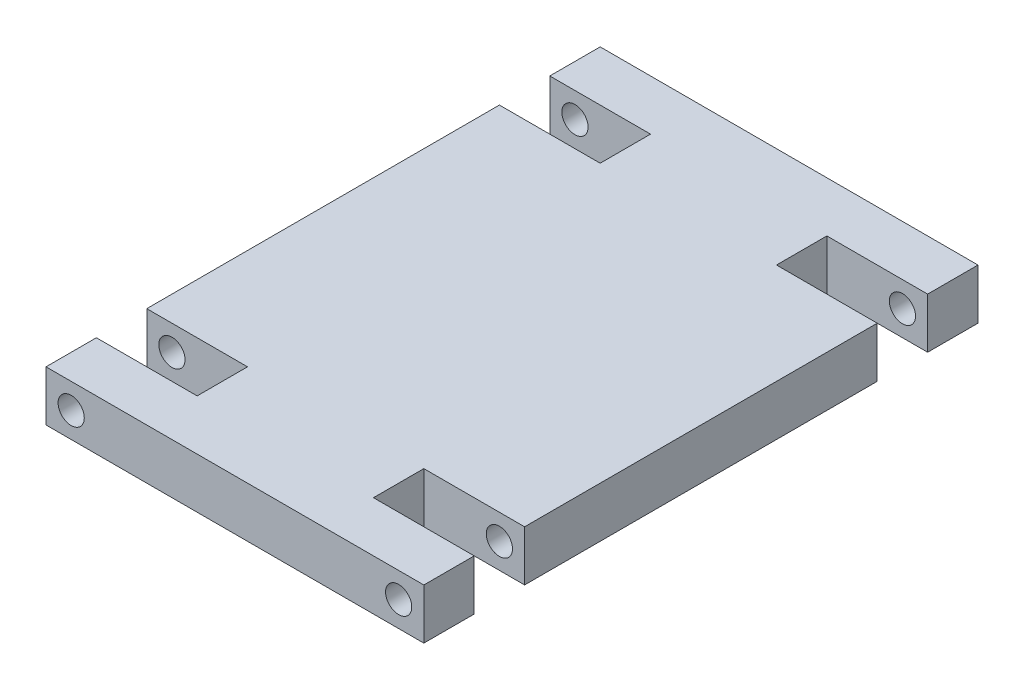
from build123d import *

# Parameters (mm, degrees)
SALIENTE_EXTRUIR1_DEPTH    = 5
CORTAR_EXTRUIR1_DEPTH      = 67.755149614
CORTAR_EXTRUIR1_DEPTH_BACK = 67.755149614
CROQUIS2_R                 = 2.6


with BuildPart() as part:
    # Croquis1 → Saliente-Extruir1 (new, symmetric)
    with BuildSketch(Plane(origin=(0, 0, 0), x_dir=(1, 0, 0), z_dir=(0, 1, 0))):
        Polygon((37.5, 45), (17.5, 45), (17.5, 35), (37.5, 35), (37.5, -35), (17.5, -35), (17.5, -45), (37.5, -45), (37.5, -55), (-37.5, -55), (-37.5, -45), (-17.5, -45), (-17.5, -35), (-37.5, -35), (-37.5, 35), (-17.5, 35), (-17.5, 45), (-37.5, 45), (-37.5, 55), (37.5, 55), align=None)
    extrude(amount=SALIENTE_EXTRUIR1_DEPTH, both=True)

    # Croquis2 → Cortar-Extruir1 (cut, two sides: drawn at the far end of the back side and taken through both)
    with BuildSketch(Plane.XY.offset(-CORTAR_EXTRUIR1_DEPTH_BACK)):
        with Locations((32.5, 0)):
            Circle(CROQUIS2_R)
        with Locations(Location((-32.5, 0, 0), (0, 0, 180))):
            Circle(CROQUIS2_R)
    extrude(amount=CORTAR_EXTRUIR1_DEPTH + CORTAR_EXTRUIR1_DEPTH_BACK, mode=Mode.SUBTRACT)


solid = part.part
